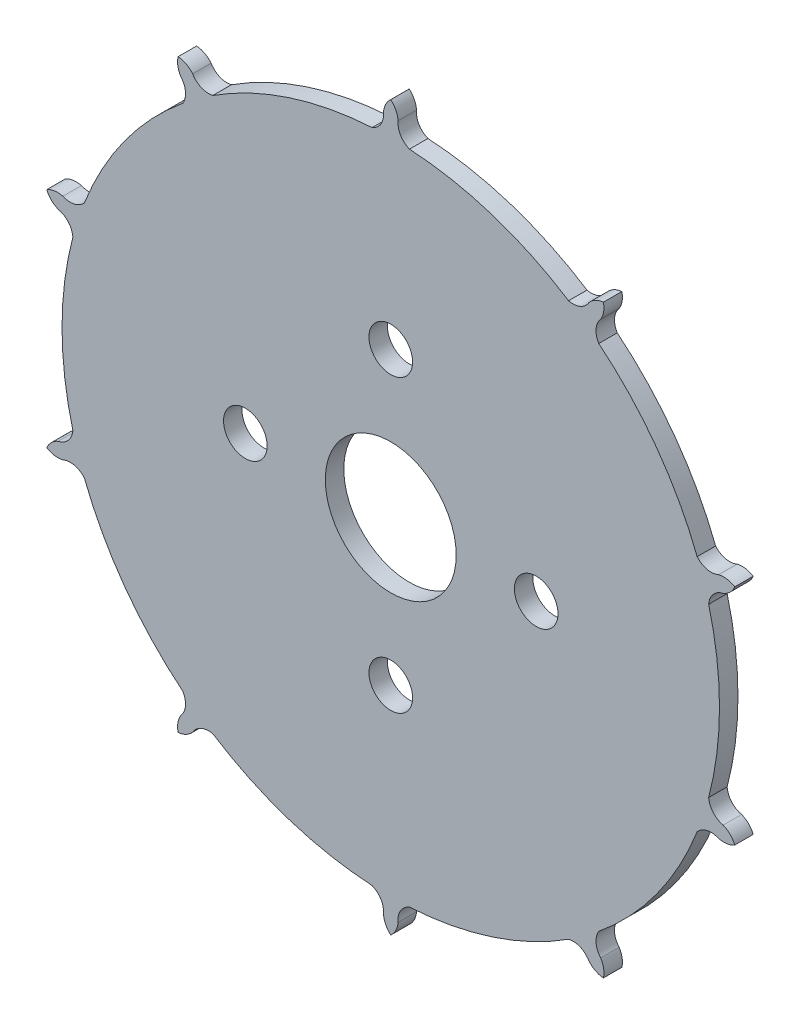
from build123d import *

# Parameters (mm, degrees)
SKETCH1_R           = 22.6042
SKETCH1_R_2         = 1.5
SKETCH1_R_3         = 4.5
BOSS_EXTRUDE2_DEPTH = 1.27
BOSS_EXTRUDE4_DEPTH = 1.27
CIRPATTERN1_COUNT   = 10


with BuildPart() as part:
    # Sketch1 → Boss-Extrude2 (new body)
    with BuildSketch(Plane.XY):
        Circle(SKETCH1_R)
        with Locations((0, 10)):
            Circle(SKETCH1_R_2, mode=Mode.SUBTRACT)
        Circle(SKETCH1_R_3, mode=Mode.SUBTRACT)
        with Locations((10, 0)):
            Circle(SKETCH1_R_2, mode=Mode.SUBTRACT)
        with Locations((0, -10)):
            Circle(SKETCH1_R_2, mode=Mode.SUBTRACT)
        with Locations((-10, 0)):
            Circle(SKETCH1_R_2, mode=Mode.SUBTRACT)
    extrude(amount=BOSS_EXTRUDE2_DEPTH)

    # Sketch2 → Boss-Extrude4 (add)
    with BuildSketch(Plane.XY.offset(1.27)):
        with BuildLine():
            ThreePointArc((0, 24.8732), (-0.350896896, 24.420773343), (-0.499962578, 23.867964213))
            ThreePointArc((-0.499962578, 23.867964213), (-0.781959135, 22.937753007), (-1.639119464, 22.479396033))
            ThreePointArc((-1.639119464, 22.479396033), (0, 22.337103215), (1.639119464, 22.479396033))
            ThreePointArc((1.639119464, 22.479396033), (0.781959135, 22.937753007), (0.499962578, 23.867964213))
            ThreePointArc((0.499962578, 23.867964213), (0.350896896, 24.420773343), (0, 24.8732))
        make_face()
    boss_extrude4 = extrude(amount=-BOSS_EXTRUDE4_DEPTH)

    # CirPattern1: Boss-Extrude4 ×10 about axis
    cirpattern1_axis = Axis((0, 0, 0), (0, 0, 1))
    for i in range(1, CIRPATTERN1_COUNT):
        add(boss_extrude4.rotate(cirpattern1_axis, i * 360 / CIRPATTERN1_COUNT))


solid = part.part
